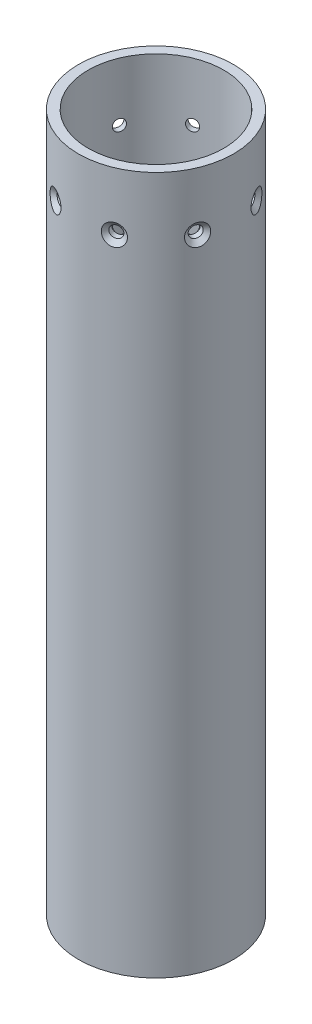
from build123d import *

# Parameters (mm, degrees)
SKETCH1_R              = 25.399999999999995
SKETCH1_R_2            = 22.224999999999994
BODY_DEPTH             = 228.6
TOP_BOLT_PATTERN_COUNT = 8


with BuildPart() as part:
    # Sketch1 → body (new body)
    with BuildSketch(Plane(origin=(0, 0, 0), x_dir=(1, 0, 0), z_dir=(0, 1, 0))):
        with Locations(Location((0, 0, 0), (0, 0, 270))):
            Circle(SKETCH1_R)
        with Locations(Location((0, 0, 0), (0, 0, 270))):
            Circle(SKETCH1_R_2, mode=Mode.SUBTRACT)
    extrude(amount=BODY_DEPTH)

    # Sketch4 → CSK for _6 Flat Head Machine Screw _100 (revolve, cut)
    with BuildSketch(Plane(origin=(9.720159182073301, 209.54999999999998, -23.466540125786675), x_dir=(-0.9238795325112865, 0, -0.3826834323650906), z_dir=(0, 1, 0))):
        Polygon((0, 0), (-1.06e-15, 4.315824014316677), (1.898649999999998, 3.174999999999999), (1.8986499999999895, 1.3800252084157083), (3.5432999999999995, -1.73e-15), align=None)
    csk_for_6_flat_head_machine_screw_100 = revolve(axis=Axis((12.150198977591623, 209.54999999999998, -29.333175157233335), (-0.38268343236509056, 0, 0.9238795325112865)), mode=Mode.SUBTRACT)

    # top-bolt-pattern: CSK for _6 Flat Head Machine Screw _100 ×8 about axis
    top_bolt_pattern_axis = Axis((0, 228.6, 0), (0, -1, 0))
    for i in range(1, TOP_BOLT_PATTERN_COUNT):
        add(csk_for_6_flat_head_machine_screw_100.rotate(top_bolt_pattern_axis, i * 360 / TOP_BOLT_PATTERN_COUNT), mode=Mode.SUBTRACT)


solid = part.part
